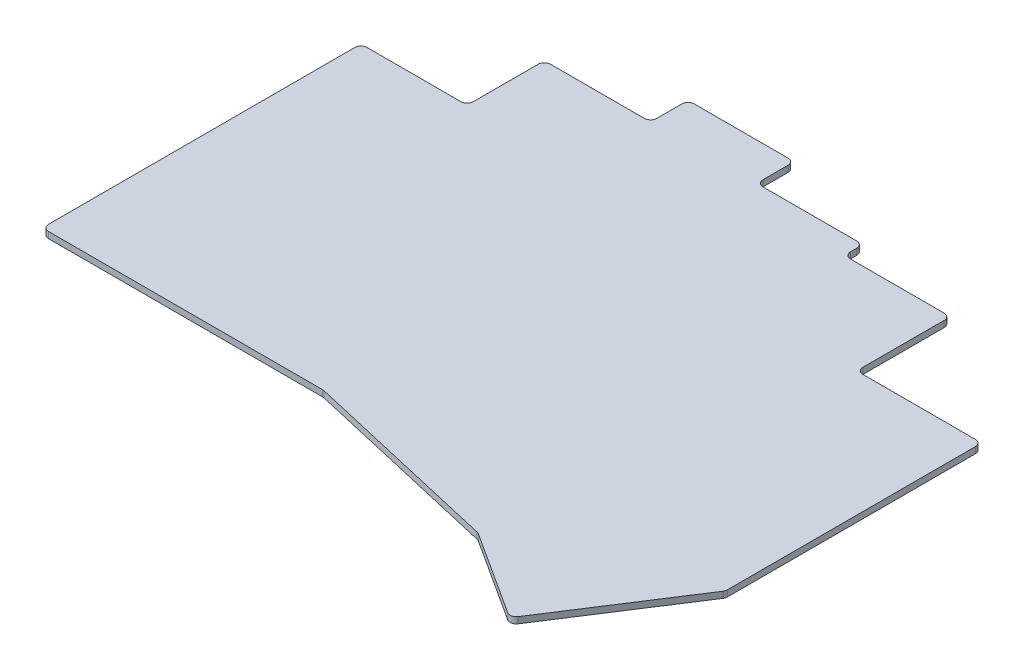
from build123d import *

# Parameters (mm, degrees)
RESSALTO_EXTRUS_O1_DEPTH = 1
FILETE1_R                = 1


with BuildPart() as part:
    # Esboço1 → Ressalto-extrusão1 (new body)
    with BuildSketch(Plane(origin=(0, 0, 0), x_dir=(1, 0, 0), z_dir=(0, 1, 0))):
        Polygon((-58.0333979, 11.326122728), (-58.0333979, 62.326122728), (-41.0333979, 62.326122728), (-41.0333979, 74.689759091), (-24.0333979, 74.689759091), (-24.0333979, 80.689759091), (-7.0333979, 80.689759091), (-7.0333979, 74.689759091), (9.9666021, 74.689759091), (9.9666021, 71.689759091), (26.9666021, 71.689759091), (26.9666021, 56.689759091), (46.9666021, 56.689759091), (46.9666021, 15.689759091), (33.403566363, -5.311289968), (19.122853002, 3.911574333), (-13.0333979, 11.326122728), align=None)
    extrude(amount=RESSALTO_EXTRUS_O1_DEPTH)

    # Filete1
    filete1_edges = [part.edges().sort_by_distance(p)[0] for p in [
        (-58.0333979, 0.5, -11.326122728),
        (-58.0333979, 0.5, -62.326122728),
        (-41.0333979, 0.5, -62.326122728),
        (-41.0333979, 0.5, -74.689759091),
        (-24.0333979, 0.5, -74.689759091),
        (-24.0333979, 0.5, -80.689759091),
        (-7.0333979, 0.5, -80.689759091),
        (-7.0333979, 0.5, -74.689759091),
        (9.9666021, 0.5, -74.689759091),
        (9.9666021, 0.5, -71.689759091),
        (26.9666021, 0.5, -71.689759091),
        (26.9666021, 0.5, -56.689759091),
        (46.9666021, 0.5, -56.689759091),
        (46.9666021, 0.5, -15.689759091),
        (33.403566363, 0.5, 5.311289968),
        (19.122853002, 0.5, -3.911574333),
        (-13.0333979, 0.5, -11.326122728),
    ]]
    fillet(filete1_edges, radius=FILETE1_R)


solid = part.part
